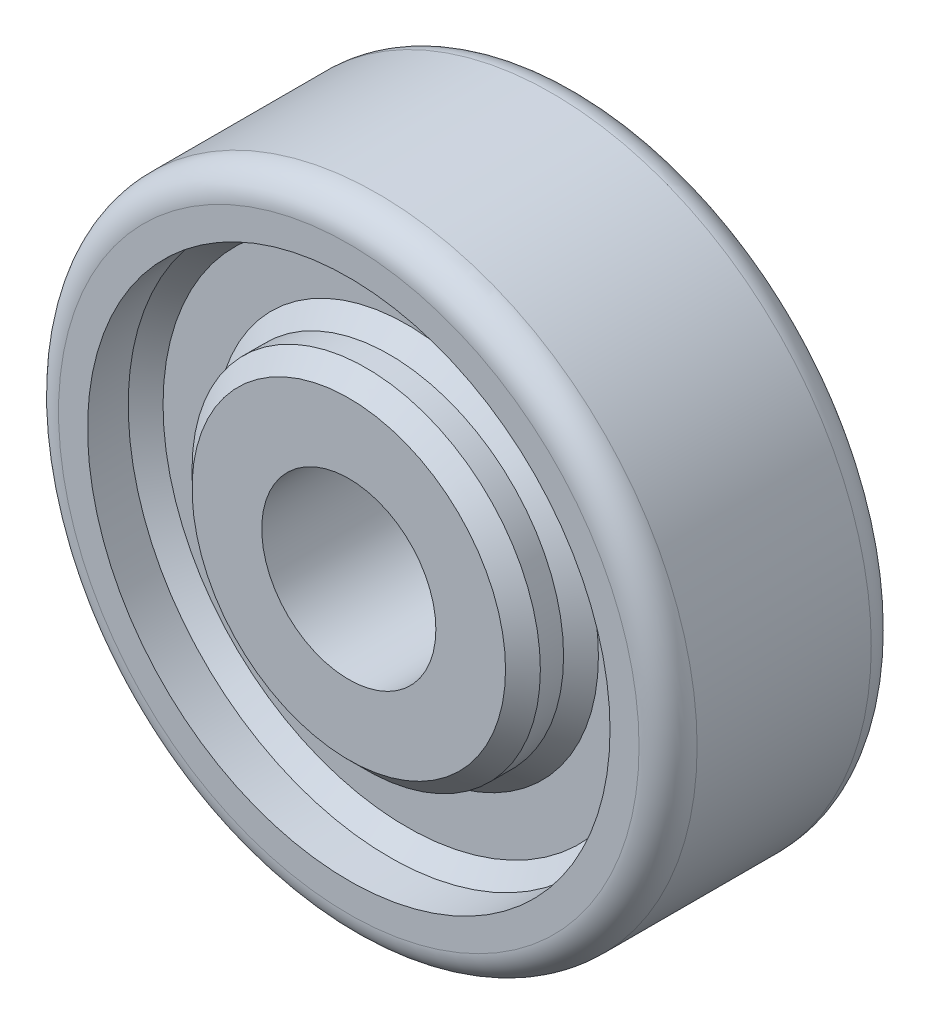
from build123d import *

# Parameters (mm, degrees)
SKETCH1_R           = 55
BOSS_EXTRUDE1_DEPTH = 20
SKETCH2_R           = 45
SKETCH2_R_2         = 30
CUT_EXTRUDE2_DEPTH  = 10
SKETCH4_R           = 15
CUT_EXTRUDE3_DEPTH  = 87
FILLET1_R           = 5
CHAMFER1_SIZE       = 3


with BuildPart() as part:
    # Sketch1 → Boss-Extrude1 (new, symmetric)
    with BuildSketch(Plane.XY):
        Circle(SKETCH1_R)
    extrude(amount=BOSS_EXTRUDE1_DEPTH, both=True)

    # Sketch2 → Cut-Extrude2 (cut)
    with BuildSketch(Plane.XY.offset(20)):
        Circle(SKETCH2_R)
        Circle(SKETCH2_R_2, mode=Mode.SUBTRACT)
    cut_extrude2 = extrude(amount=-CUT_EXTRUDE2_DEPTH, mode=Mode.SUBTRACT)

    # Mirror1: Cut-Extrude2 across plane
    add(cut_extrude2.mirror(Plane.XY), mode=Mode.SUBTRACT)

    # Sketch4 → Cut-Extrude3 (cut)
    with BuildSketch(Plane.XY.offset(20)):
        Circle(SKETCH4_R)
    extrude(amount=-CUT_EXTRUDE3_DEPTH, mode=Mode.SUBTRACT)

    # Fillet1
    fillet1_edges = [part.edges().sort_by_distance(p)[0] for p in [
        (-55, 0, -20),
        (-55, 0, 20),
    ]]
    fillet(fillet1_edges, radius=FILLET1_R)

    # Chamfer1
    chamfer1_edges = [part.edges().sort_by_distance(p)[0] for p in [
        (-30, 0, -20),
        (-45, 0, 10),
        (-30, 0, 10),
        (-30, 0, 20),
    ]]
    chamfer(chamfer1_edges, length=CHAMFER1_SIZE)


solid = part.part
